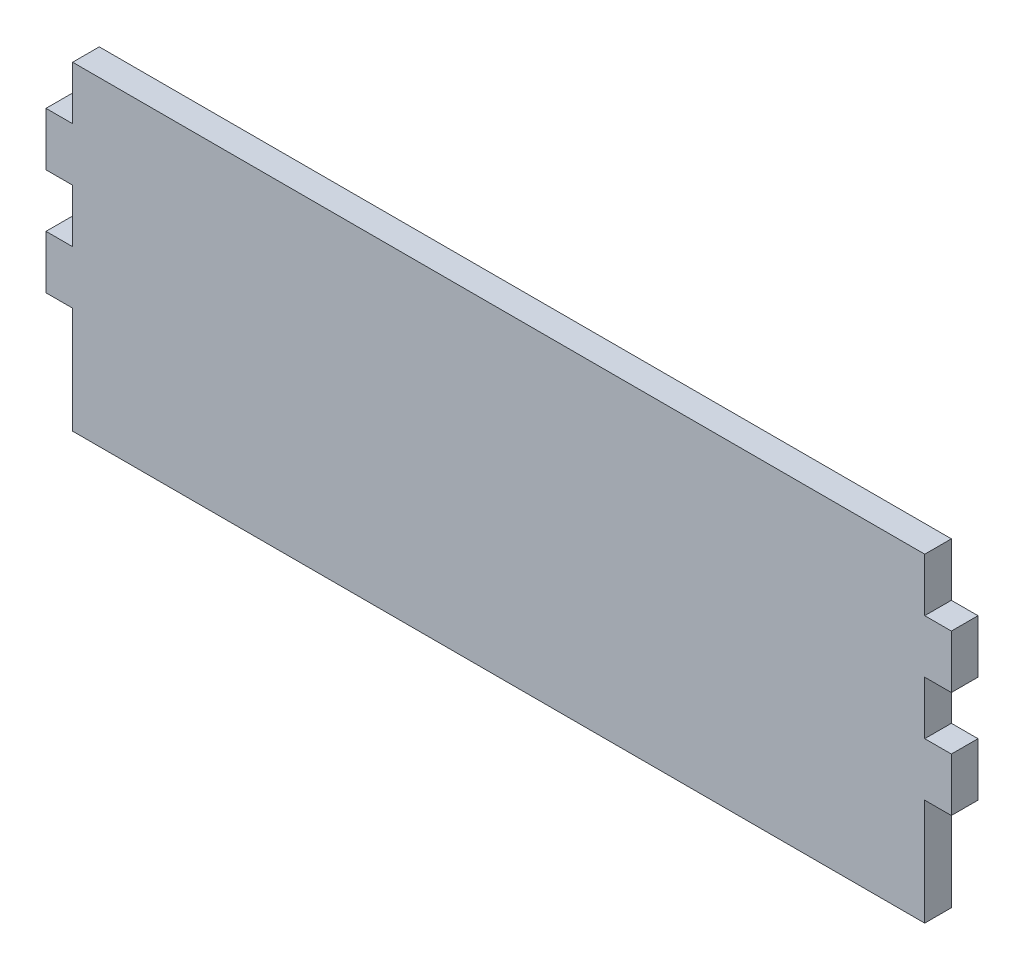
from build123d import *

# Parameters (mm, degrees)
BOSS_EXTRUDE1_DEPTH = 2.5


with BuildPart() as part:
    # Sketch1 → Boss-Extrude1 (new body)
    with BuildSketch(Plane.XY):
        Polygon((-42.5, 15), (-42.5, 10), (-40, 10), (-40, 0), (40, 0), (40, 10), (42.5, 10), (42.5, 15), (40, 15), (40, 20), (42.5, 20), (42.5, 25), (40, 25), (40, 30), (-40, 30), (-40, 25), (-42.5, 25), (-42.5, 20), (-40, 20), (-40, 15), align=None)
    extrude(amount=BOSS_EXTRUDE1_DEPTH)


solid = part.part
